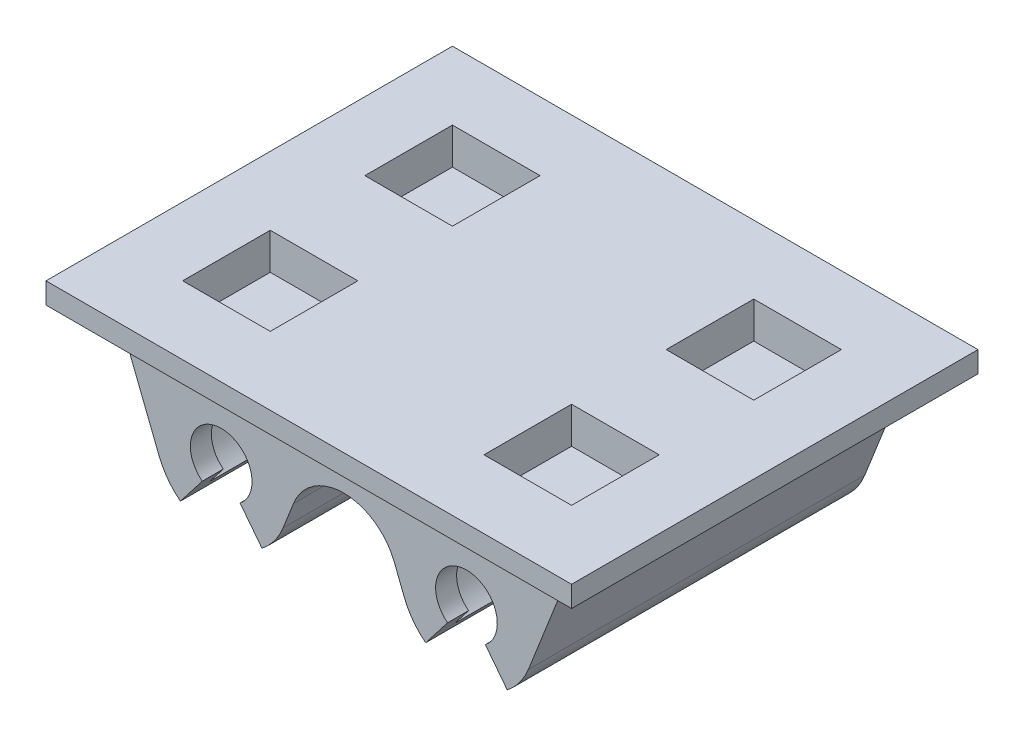
from build123d import *

# Parameters (mm, degrees)
BOSS_EXTRUDE1_DEPTH = 48
BOSS_EXTRUDE2_START = -3
BOSS_EXTRUDE2_DEPTH = 3
SKETCH3_W           = 75
SKETCH3_H           = 58
BOSS_EXTRUDE3_DEPTH = 3
SKETCH4_W           = 12.5
SKETCH4_H           = 12.5
CUT_EXTRUDE1_DEPTH  = 5.2


with BuildPart() as part:
    # Sketch1 → Boss-Extrude1 (new body)
    with BuildSketch(Plane.XY):
        with BuildLine():
            Line((-32.6359499, 12.129277561), (32.3640501, 12.129277561))
            Line((32.3640501, 12.129277561), (26.200760796, -3.487483918))
            ThreePointArc((26.200760796, -3.487483918), (24.961869302, -5.702906573), (23.180569313, -7.51119859))
            Line((23.180569313, -7.51119859), (22.01726547, -6.008958872))
            ThreePointArc((22.01726547, -6.008958872), (17.3640501, 7.6), (12.710834731, -6.008958872))
            Line((12.710834731, -6.008958872), (11.547530888, -7.51119859))
            ThreePointArc((11.547530888, -7.51119859), (9.766230899, -5.702906573), (8.527339405, -3.487483918))
            Line((8.527339405, -3.487483918), (7.046449616, 0.264847258))
            ThreePointArc((7.046449616, 0.264847258), (-0.1359499, 5.15176662), (-7.318349416, 0.264847258))
            Line((-7.318349416, 0.264847258), (-8.799239204, -3.487483918))
            ThreePointArc((-8.799239204, -3.487483918), (-10.038130698, -5.702906573), (-11.819430687, -7.51119859))
            Line((-11.819430687, -7.51119859), (-12.98273453, -6.008958872))
            ThreePointArc((-12.98273453, -6.008958872), (-17.6359499, 7.6), (-22.289165269, -6.008958872))
            Line((-22.289165269, -6.008958872), (-23.452469112, -7.51119859))
            ThreePointArc((-23.452469112, -7.51119859), (-25.233769101, -5.702906573), (-26.472660595, -3.487483918))
            Line((-26.472660595, -3.487483918), (-32.6359499, 12.129277561))
        make_face()
    extrude(amount=BOSS_EXTRUDE1_DEPTH)

    # Sketch2 → Boss-Extrude2 (add)
    with BuildSketch(Plane.XY.offset(48).offset(BOSS_EXTRUDE2_START)):
        with BuildLine():
            Line((22.01726547, -6.008958872), (20.058016894, -3.478870926))
            ThreePointArc((20.058016894, -3.478870926), (17.3640501, 4.4), (14.670083307, -3.478870926))
            Line((14.670083307, -3.478870926), (12.710834731, -6.008958872))
            ThreePointArc((12.710834731, -6.008958872), (17.3640501, 7.6), (22.01726547, -6.008958872))
        make_face()
        with BuildLine():
            Line((-12.98273453, -6.008958872), (-14.941983106, -3.478870926))
            ThreePointArc((-14.941983106, -3.478870926), (-17.6359499, 4.4), (-20.329916693, -3.478870926))
            Line((-20.329916693, -3.478870926), (-22.289165269, -6.008958872))
            ThreePointArc((-22.289165269, -6.008958872), (-17.6359499, 7.6), (-12.98273453, -6.008958872))
        make_face()
    extrude(amount=BOSS_EXTRUDE2_DEPTH)

    # Sketch3 → Boss-Extrude3 (add)
    with BuildSketch(Plane(origin=(0, 12.129277561, 0), x_dir=(1, 0, 0), z_dir=(0, 1, 0))):
        with Locations((-0.1359499, -24)):
            Rectangle(SKETCH3_W, SKETCH3_H)
    extrude(amount=BOSS_EXTRUDE3_DEPTH)

    # Sketch4 → Cut-Extrude1 (cut)
    with BuildSketch(Plane(origin=(0, 15.129277561, 0), x_dir=(1, 0, 0), z_dir=(0, 1, 0))):
        with Locations((21.3640501, -11)):
            Rectangle(SKETCH4_W, SKETCH4_H)
        with Locations((21.3640501, -37)):
            Rectangle(SKETCH4_W, SKETCH4_H)
        with Locations((-21.6359499, -37)):
            Rectangle(SKETCH4_W, SKETCH4_H)
        with Locations((-21.6359499, -11)):
            Rectangle(SKETCH4_W, SKETCH4_H)
    extrude(amount=-CUT_EXTRUDE1_DEPTH, mode=Mode.SUBTRACT)


solid = part.part
